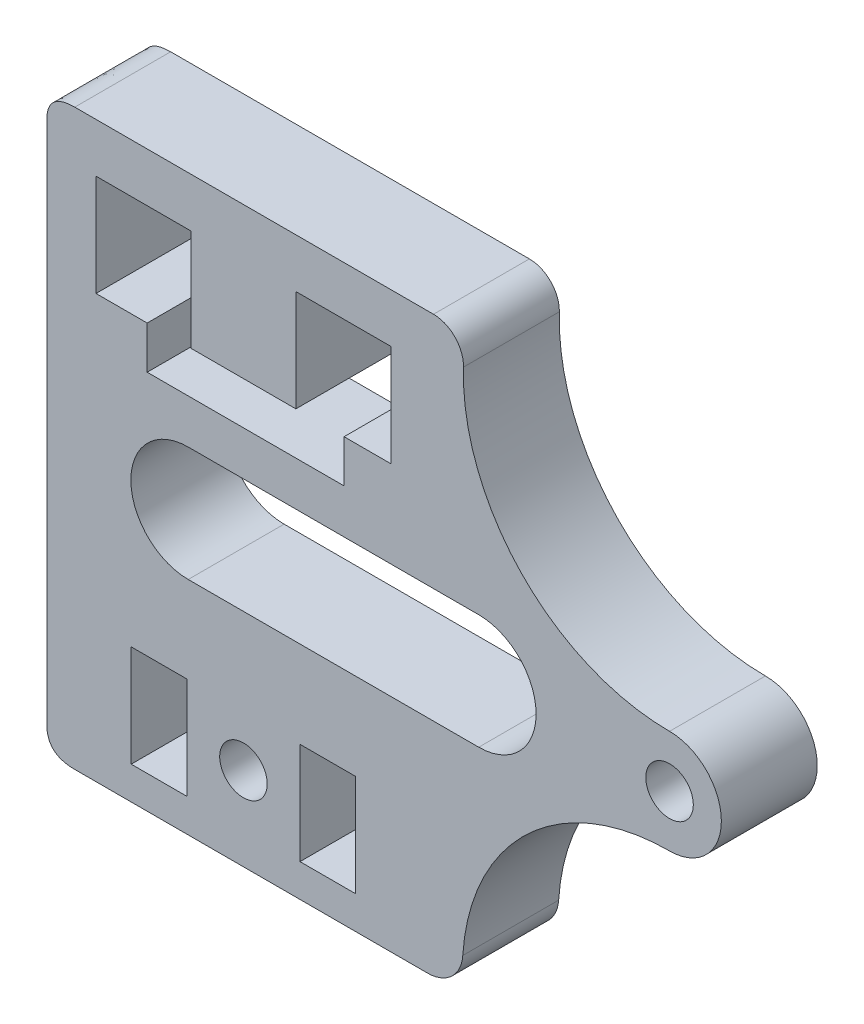
from build123d import *

# Parameters (mm, degrees)
SKETCH1_R           = 1.449961854
SKETCH1_R_2         = 1.45
SKETCH1_W           = 3.400011
SKETCH1_H           = 6.199989
BOSS_EXTRUDE2_DEPTH = 5.85


with BuildPart() as part:
    # Sketch1 → Boss-Extrude2 (new body)
    with BuildSketch(Plane.XY):
        with BuildLine():
            Line((389.265872387, 564.138903138), (411.155971541, 564.138903138))
            ThreePointArc((411.155971541, 564.138903138), (412.46753945, 563.584161878), (412.982994127, 562.256662455))
            ThreePointArc((412.982994127, 562.256662455), (416.531053859, 553.119006976), (425.559046996, 549.30052358))
            ThreePointArc((425.559046996, 549.30052358), (428.720667438, 546.138903138), (425.559046996, 542.977282695))
            ThreePointArc((425.559046996, 542.977282695), (416.910383014, 539.55653755), (412.941547102, 531.145281549))
            ThreePointArc((412.941547102, 531.145281549), (412.268542883, 529.718966402), (410.801969943, 529.138903138))
            Line((410.801969943, 529.138903138), (389.265871713, 529.138903138))
            add(Edge.make_bspline(
                [(387.560996, 530.842035377), (387.467163743, 529.138903138), (389.265871713, 529.138903138)],
                knots=[0, 0, 0, 1, 1, 1], degree=2))
            Line((387.560996, 530.842035377), (387.560996, 562.435769381))
            add(Edge.make_bspline(
                [(387.560996, 562.435769381), (387.467162762, 564.138903138), (389.265872387, 564.138903138)],
                knots=[0, 0, 0, 1, 1, 1], degree=2))
        make_face()
        with Locations((425.559046996, 546.138903138)):
            Circle(SKETCH1_R, mode=Mode.SUBTRACT)
        with Locations((399.559046996, 534.238897638)):
            Circle(SKETCH1_R_2, mode=Mode.SUBTRACT)
        Polygon((405.698755359, 552.338914138), (405.698755359, 554.938914138), (408.557097991, 554.938914138), (408.557097991, 561.138903138), (402.757097991, 561.138903138), (402.757097991, 554.938914138), (396.360996, 554.938914138), (396.360996, 561.138903138), (390.560996, 561.138903138), (390.560996, 554.938914138), (393.683007359, 554.938914138), (393.683007359, 552.338914138), align=None, mode=Mode.SUBTRACT)
        with Locations((394.409041496, 534.238897638)):
            Rectangle(SKETCH1_W, SKETCH1_H, mode=Mode.SUBTRACT)
        with Locations((404.709052496, 534.238897638)):
            Rectangle(SKETCH1_W, SKETCH1_H, mode=Mode.SUBTRACT)
        with BuildLine():
            Line((396.188262357, 549.638903138), (413.915690223, 549.638903138))
            ThreePointArc((413.915690223, 549.638903138), (417.415690223, 546.138903138), (413.915690223, 542.638903138))
            Line((413.915690223, 542.638903138), (396.188262357, 542.638903138))
            ThreePointArc((396.188262357, 542.638903138), (392.688262357, 546.138903138), (396.188262357, 549.638903138))
        make_face(mode=Mode.SUBTRACT)
    extrude(amount=BOSS_EXTRUDE2_DEPTH)


solid = part.part
